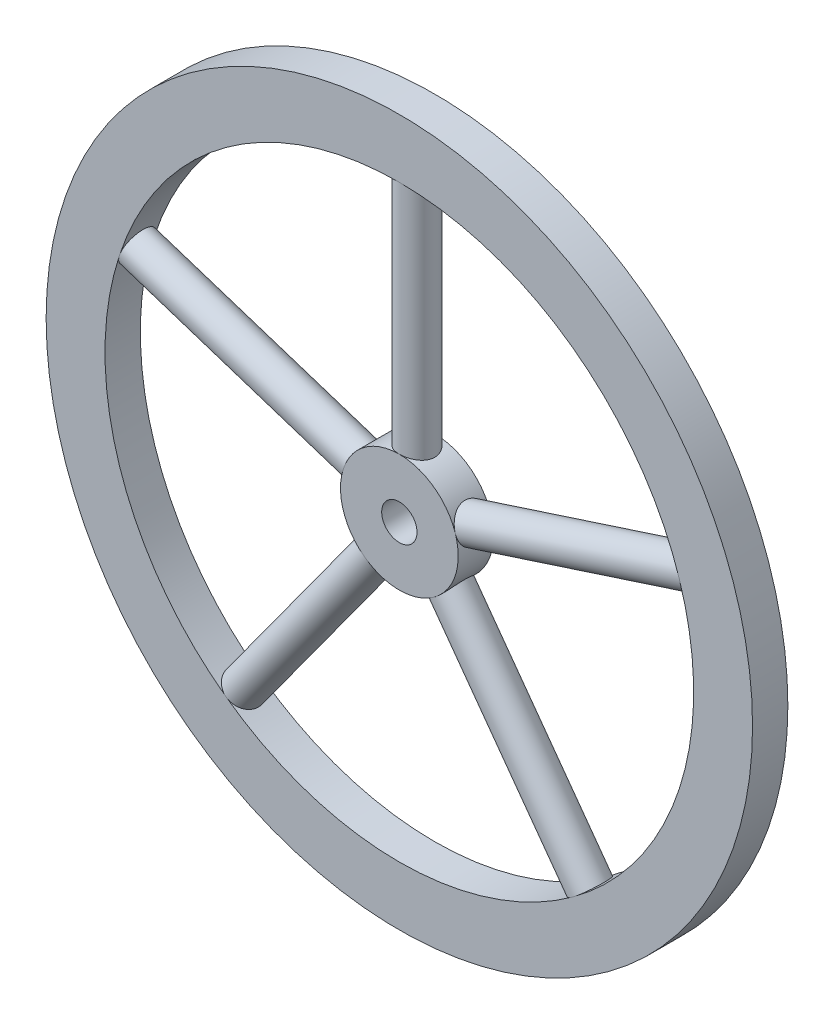
from build123d import *

# Parameters (mm, degrees)
SKETCH1_R             = 300
SKETCH1_R_2           = 250
BOSS_EXTRUDE1_DEPTH   = 15
SKETCH1_R_3           = 50
SKETCH1_R_4           = 15
BOSS_EXTRUDE1_2_DEPTH = 15
SKETCH2_W             = 15
SKETCH2_H             = 250
CIRPATTERN1_COUNT     = 5


with BuildPart() as part:
    # Sketch1 → Boss-Extrude1 (new, symmetric)
    with BuildSketch(Plane.XY):
        Circle(SKETCH1_R)
        Circle(SKETCH1_R_2, mode=Mode.SUBTRACT)
    extrude(amount=BOSS_EXTRUDE1_DEPTH, both=True)



with BuildPart() as body_2:
    # Sketch1 → Boss-Extrude1 2 (new, symmetric)
    with BuildSketch(Plane.XY):
        Circle(SKETCH1_R_3)
        Circle(SKETCH1_R_4, mode=Mode.SUBTRACT)
    extrude(amount=BOSS_EXTRUDE1_2_DEPTH, both=True)


with BuildPart() as part_1:
    add(part.part)

    add(body_2.part)  # Revolve1 merges body 2
    # Sketch2 → Revolve1 (revolve)
    with BuildSketch(Plane.XY, mode=Mode.PRIVATE) as revolve1_sk:
        with Locations((7.5, 140)):
            Rectangle(SKETCH2_W, SKETCH2_H)
    revolve1 = revolve(revolve1_sk.sketch.rotate(Axis((0, 0, 0), (0, 1, 0)), 90), axis=Axis((0, 0, 0), (0, 1, 0)))

    # CirPattern1: Revolve1 ×5 about axis
    cirpattern1_axis = Axis((0, 0, 15), (0, 0, -1))
    for i in range(1, CIRPATTERN1_COUNT):
        add(revolve1.rotate(cirpattern1_axis, i * 360 / CIRPATTERN1_COUNT))


solid = part_1.part
